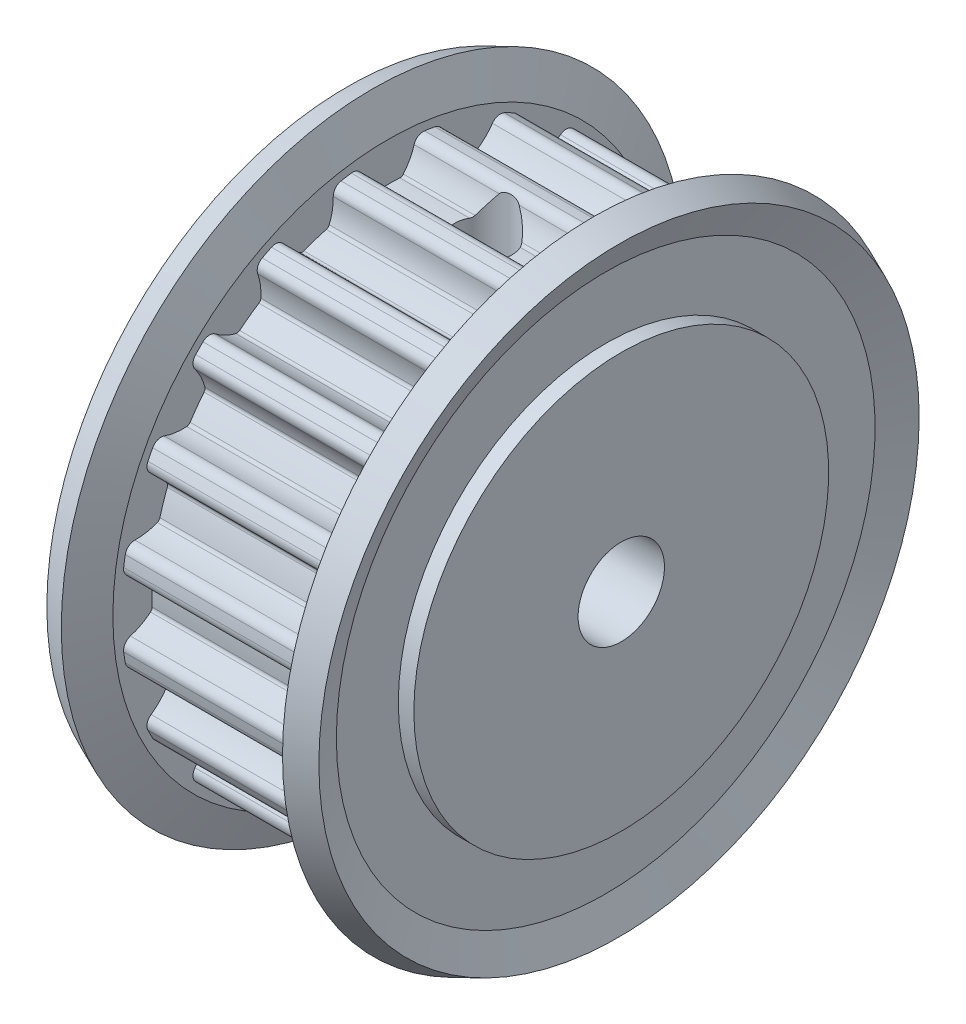
from build123d import *

# Parameters (mm, degrees)
SKETCH_2_W           = 16
SKETCH_2_H           = 18
CUT_EXTRUDE_1_DEPTH  = 11
CUT_EXTRUDE_2_DEPTH  = 11
CUT_EXTRUDE_3_DEPTH  = 11
CUT_EXTRUDE_4_DEPTH  = 11
CUT_EXTRUDE_5_DEPTH  = 11
CUT_EXTRUDE_6_DEPTH  = 11
CUT_EXTRUDE_7_DEPTH  = 11
CUT_EXTRUDE_8_DEPTH  = 11
CUT_EXTRUDE_9_DEPTH  = 11
CUT_EXTRUDE_10_DEPTH = 11
CUT_EXTRUDE_11_DEPTH = 11
CUT_EXTRUDE_12_DEPTH = 11
CUT_EXTRUDE_13_DEPTH = 11
CUT_EXTRUDE_14_DEPTH = 11
CUT_EXTRUDE_15_DEPTH = 11
CUT_EXTRUDE_16_DEPTH = 11
CUT_EXTRUDE_17_DEPTH = 11
CUT_EXTRUDE_18_DEPTH = 11
CUT_EXTRUDE_19_DEPTH = 11
CUT_EXTRUDE_20_DEPTH = 11
SKETCH_24_W          = 1.621
SKETCH_24_H          = 12.76


with BuildPart() as part:
    # 草图1 → 旋转1 (revolve)
    with BuildSketch(Plane.XY):
        Polygon((0, 12), (0, 2.5), (28, 2.5), (28, 4.175), (16, 4.175), (16, 12), (15.1, 12), (15.1, 15.584417878), (15.868987169, 17.365904819), (14.4, 18), (13.5, 15.915), (13.5, 15.435), (2.5, 15.435), (2.5, 15.915), (1.6, 18), (0.131012831, 17.365904819), (0.9, 15.584417878), (0.9, 12), align=None)
    revolve(axis=Axis((28, 0, 0), (-1, 0, 0)))

    # 草图2 → 切除-旋转1 (revolve, cut)
    with BuildSketch(Plane.XY):
        with Locations((24, 9)):
            Rectangle(SKETCH_2_W, SKETCH_2_H)
    revolve(axis=Axis((32, 0, 0), (-1, 0, 0)), mode=Mode.SUBTRACT)

    # 草图3 → 切除-拉伸1 (cut)
    with BuildSketch(Plane(origin=(2.5, 0, 0), x_dir=(0, 0, -1), z_dir=(1, 0, 0))):
        with BuildLine():
            Line((2.117582594, 15.289050623), (2.117582594, 20.58))
            Line((2.117582594, 20.58), (-2.117582594, 20.58))
            Line((-2.117582594, 20.58), (-2.117582594, 15.289050623))
            ThreePointArc((-2.117582594, 15.289050623), (-1.744204447, 15.206574401), (-1.514826938, 14.900634005))
            ThreePointArc((-1.514826938, 14.900634005), (-1.262981105, 14.287416305), (-0.892805689, 13.737477734))
            ThreePointArc((-0.892805689, 13.737477734), (-0.801013519, 13.668400532), (-0.688019523, 13.647668451))
            ThreePointArc((-0.688019523, 13.647668451), (0, 13.665), (0.688019523, 13.647668451))
            ThreePointArc((0.688019523, 13.647668451), (0.801013545, 13.668400543), (0.892805724, 13.737477777))
            ThreePointArc((0.892805724, 13.737477777), (1.26298113, 14.287416352), (1.514826953, 14.900634054))
            ThreePointArc((1.514826953, 14.900634054), (1.744204469, 15.206574415), (2.117582594, 15.289050623))
        make_face()
    extrude(amount=CUT_EXTRUDE_1_DEPTH, mode=Mode.SUBTRACT)

    # 草图5 → 切除-拉伸2 (cut)
    with BuildSketch(Plane(origin=(2.5, 0, 0), x_dir=(0, 0, -1), z_dir=(1, 0, 0))):
        with BuildLine():
            Line((-2.710635746, 15.195120232), (-4.34562902, 20.227112114))
            Line((-4.34562902, 20.227112114), (-8.373510469, 18.918374097))
            Line((-8.373510469, 18.918374097), (-6.738517195, 13.886382215))
            ThreePointArc((-6.738517195, 13.886382215), (-6.357926921, 13.923322859), (-6.045235165, 13.7032378))
            ThreePointArc((-6.045235165, 13.7032378), (-5.616220854, 13.197857753), (-5.094222748, 12.789225586))
            ThreePointArc((-5.094222748, 12.789225586), (-4.985577177, 12.751894603), (-4.871706936, 12.767094287))
            ThreePointArc((-4.871706936, 12.767094287), (-4.222717228, 12.996187295), (-3.563016034, 13.192313737))
            ThreePointArc((-3.563016034, 13.192313737), (-3.461958902, 13.246948202), (-3.396005391, 13.341009898))
            ThreePointArc((-3.396005391, 13.341009898), (-3.213888025, 13.978423056), (-3.163863105, 14.639452386))
            ThreePointArc((-3.163863105, 14.639452386), (-3.040252895, 15.001300511), (-2.710635746, 15.195120232))
        make_face()
    extrude(amount=CUT_EXTRUDE_2_DEPTH, mode=Mode.SUBTRACT)

    # 草图6 → 切除-拉伸3 (cut)
    with BuildSketch(Plane(origin=(2.5, 0, 0), x_dir=(0, 0, -1), z_dir=(1, 0, 0))):
        with BuildLine():
            Line((-7.273518173, 13.613785601), (-10.383460187, 17.894253563))
            Line((-10.383460187, 17.894253563), (-13.809780797, 15.404885925))
            Line((-13.809780797, 15.404885925), (-10.699838783, 11.124417963))
            ThreePointArc((-10.699838783, 11.124417963), (-10.34929121, 11.277159466), (-9.983893654, 11.164473203))
            ThreePointArc((-9.983893654, 11.164473203), (-9.419705775, 10.816400929), (-8.796981791, 10.58907493))
            ThreePointArc((-8.796981791, 10.58907493), (-8.682117805, 10.587144383), (-8.57851773, 10.636787981))
            ThreePointArc((-8.57851773, 10.636787981), (-8.032085473, 11.055217228), (-7.465278757, 11.445603439))
            ThreePointArc((-7.465278757, 11.445603439), (-7.386050691, 11.528792273), (-7.352391837, 11.638631019))
            ThreePointArc((-7.352391837, 11.638631019), (-7.376159427, 12.301124317), (-7.532852198, 12.94525912))
            ThreePointArc((-7.532852198, 12.94525912), (-7.527109122, 13.327594792), (-7.273518173, 13.613785601))
        make_face()
    extrude(amount=CUT_EXTRUDE_3_DEPTH, mode=Mode.SUBTRACT)

    # 草图7 → 切除-拉伸4 (cut)
    with BuildSketch(Plane(origin=(2.5, 0, 0), x_dir=(0, 0, -1), z_dir=(1, 0, 0))):
        with BuildLine():
            Line((-11.124417963, 10.699838783), (-15.404885925, 13.809780797))
            Line((-15.404885925, 13.809780797), (-17.894253563, 10.383460187))
            Line((-17.894253563, 10.383460187), (-13.613785601, 7.273518173))
            ThreePointArc((-13.613785601, 7.273518173), (-13.327594768, 7.527109132), (-12.945259071, 7.532852181))
            ThreePointArc((-12.945259071, 7.532852181), (-12.301124264, 7.37615942), (-11.638630964, 7.352391841))
            ThreePointArc((-11.638630964, 7.352391841), (-11.528792249, 7.386050705), (-11.445603439, 7.465278757))
            ThreePointArc((-11.445603439, 7.465278757), (-11.055217228, 8.032085473), (-10.636787981, 8.57851773))
            ThreePointArc((-10.636787981, 8.57851773), (-10.587144377, 8.682117832), (-10.589074943, 8.796981844))
            ThreePointArc((-10.589074943, 8.796981844), (-10.816400952, 9.419705823), (-11.164473234, 9.983893695))
            ThreePointArc((-11.164473234, 9.983893695), (-11.277159464, 10.349291236), (-11.124417963, 10.699838783))
        make_face()
    extrude(amount=CUT_EXTRUDE_4_DEPTH, mode=Mode.SUBTRACT)

    # 草图8 → 切除-拉伸5 (cut)
    with BuildSketch(Plane(origin=(2.5, 0, 0), x_dir=(0, 0, -1), z_dir=(1, 0, 0))):
        with BuildLine():
            Line((-13.886382215, 6.738517195), (-18.918374097, 8.373510469))
            Line((-18.918374097, 8.373510469), (-20.227112114, 4.34562902))
            Line((-20.227112114, 4.34562902), (-15.195120232, 2.710635746))
            ThreePointArc((-15.195120232, 2.710635746), (-15.001300491, 3.040252911), (-14.639452335, 3.163863104))
            ThreePointArc((-14.639452335, 3.163863104), (-13.978423003, 3.213888034), (-13.341009847, 3.396005412))
            ThreePointArc((-13.341009847, 3.396005412), (-13.246948183, 3.461958923), (-13.192313737, 3.563016034))
            ThreePointArc((-13.192313737, 3.563016034), (-12.996187295, 4.222717228), (-12.767094287, 4.871706936))
            ThreePointArc((-12.767094287, 4.871706936), (-12.751894606, 4.985577205), (-12.789225615, 5.094222795))
            ThreePointArc((-12.789225615, 5.094222795), (-13.19785779, 5.616220893), (-13.703237842, 6.045235194))
            ThreePointArc((-13.703237842, 6.045235194), (-13.923322866, 6.357926946), (-13.886382215, 6.738517195))
        make_face()
    extrude(amount=CUT_EXTRUDE_5_DEPTH, mode=Mode.SUBTRACT)

    # 草图9 → 切除-拉伸6 (cut)
    with BuildSketch(Plane(origin=(2.5, 0, 0), x_dir=(0, 0, -1), z_dir=(1, 0, 0))):
        with BuildLine():
            Line((-15.289050623, 2.117582594), (-20.58, 2.117582594))
            Line((-20.58, 2.117582594), (-20.58, -2.117582594))
            Line((-20.58, -2.117582594), (-15.289050623, -2.117582594))
            ThreePointArc((-15.289050623, -2.117582594), (-15.206574401, -1.744204447), (-14.900634005, -1.514826938))
            ThreePointArc((-14.900634005, -1.514826938), (-14.287416305, -1.262981105), (-13.737477734, -0.892805689))
            ThreePointArc((-13.737477734, -0.892805689), (-13.668400532, -0.801013519), (-13.647668451, -0.688019523))
            ThreePointArc((-13.647668451, -0.688019523), (-13.665, 0), (-13.647668451, 0.688019523))
            ThreePointArc((-13.647668451, 0.688019523), (-13.668400543, 0.801013545), (-13.737477777, 0.892805724))
            ThreePointArc((-13.737477777, 0.892805724), (-14.287416352, 1.26298113), (-14.900634054, 1.514826953))
            ThreePointArc((-14.900634054, 1.514826953), (-15.206574415, 1.744204469), (-15.289050623, 2.117582594))
        make_face()
    extrude(amount=CUT_EXTRUDE_6_DEPTH, mode=Mode.SUBTRACT)

    # 草图10 → 切除-拉伸7 (cut)
    with BuildSketch(Plane(origin=(2.5, 0, 0), x_dir=(0, 0, -1), z_dir=(1, 0, 0))):
        with BuildLine():
            Line((-15.195120232, -2.710635746), (-20.227112114, -4.34562902))
            Line((-20.227112114, -4.34562902), (-18.918374097, -8.373510469))
            Line((-18.918374097, -8.373510469), (-13.886382215, -6.738517195))
            ThreePointArc((-13.886382215, -6.738517195), (-13.923322859, -6.357926921), (-13.7032378, -6.045235165))
            ThreePointArc((-13.7032378, -6.045235165), (-13.197857753, -5.616220854), (-12.789225586, -5.094222748))
            ThreePointArc((-12.789225586, -5.094222748), (-12.751894603, -4.985577177), (-12.767094287, -4.871706936))
            ThreePointArc((-12.767094287, -4.871706936), (-12.996187295, -4.222717228), (-13.192313737, -3.563016034))
            ThreePointArc((-13.192313737, -3.563016034), (-13.246948202, -3.461958902), (-13.341009898, -3.396005391))
            ThreePointArc((-13.341009898, -3.396005391), (-13.978423056, -3.213888025), (-14.639452386, -3.163863105))
            ThreePointArc((-14.639452386, -3.163863105), (-15.001300511, -3.040252895), (-15.195120232, -2.710635746))
        make_face()
    extrude(amount=CUT_EXTRUDE_7_DEPTH, mode=Mode.SUBTRACT)

    # 草图11 → 切除-拉伸8 (cut)
    with BuildSketch(Plane(origin=(2.5, 0, 0), x_dir=(0, 0, -1), z_dir=(1, 0, 0))):
        with BuildLine():
            Line((-13.613785601, -7.273518173), (-17.894253563, -10.383460187))
            Line((-17.894253563, -10.383460187), (-15.404885925, -13.809780797))
            Line((-15.404885925, -13.809780797), (-11.124417963, -10.699838783))
            ThreePointArc((-11.124417963, -10.699838783), (-11.277159466, -10.34929121), (-11.164473203, -9.983893654))
            ThreePointArc((-11.164473203, -9.983893654), (-10.816400929, -9.419705775), (-10.58907493, -8.796981791))
            ThreePointArc((-10.58907493, -8.796981791), (-10.587144383, -8.682117805), (-10.636787981, -8.57851773))
            ThreePointArc((-10.636787981, -8.57851773), (-11.055217228, -8.032085473), (-11.445603439, -7.465278757))
            ThreePointArc((-11.445603439, -7.465278757), (-11.528792273, -7.386050691), (-11.638631019, -7.352391837))
            ThreePointArc((-11.638631019, -7.352391837), (-12.301124317, -7.376159427), (-12.94525912, -7.532852198))
            ThreePointArc((-12.94525912, -7.532852198), (-13.327594792, -7.527109122), (-13.613785601, -7.273518173))
        make_face()
    extrude(amount=CUT_EXTRUDE_8_DEPTH, mode=Mode.SUBTRACT)

    # 草图12 → 切除-拉伸9 (cut)
    with BuildSketch(Plane(origin=(2.5, 0, 0), x_dir=(0, 0, -1), z_dir=(1, 0, 0))):
        with BuildLine():
            Line((-10.699838783, -11.124417963), (-13.809780797, -15.404885925))
            Line((-13.809780797, -15.404885925), (-10.383460187, -17.894253563))
            Line((-10.383460187, -17.894253563), (-7.273518173, -13.613785601))
            ThreePointArc((-7.273518173, -13.613785601), (-7.527109132, -13.327594768), (-7.532852181, -12.945259071))
            ThreePointArc((-7.532852181, -12.945259071), (-7.37615942, -12.301124264), (-7.352391841, -11.638630964))
            ThreePointArc((-7.352391841, -11.638630964), (-7.386050705, -11.528792249), (-7.465278757, -11.445603439))
            ThreePointArc((-7.465278757, -11.445603439), (-8.032085473, -11.055217228), (-8.57851773, -10.636787981))
            ThreePointArc((-8.57851773, -10.636787981), (-8.682117832, -10.587144377), (-8.796981844, -10.589074943))
            ThreePointArc((-8.796981844, -10.589074943), (-9.419705823, -10.816400952), (-9.983893695, -11.164473234))
            ThreePointArc((-9.983893695, -11.164473234), (-10.349291236, -11.277159464), (-10.699838783, -11.124417963))
        make_face()
    extrude(amount=CUT_EXTRUDE_9_DEPTH, mode=Mode.SUBTRACT)

    # 草图13 → 切除-拉伸10 (cut)
    with BuildSketch(Plane(origin=(2.5, 0, 0), x_dir=(0, 0, -1), z_dir=(1, 0, 0))):
        with BuildLine():
            Line((-6.738517195, -13.886382215), (-8.373510469, -18.918374097))
            Line((-8.373510469, -18.918374097), (-4.34562902, -20.227112114))
            Line((-4.34562902, -20.227112114), (-2.710635746, -15.195120232))
            ThreePointArc((-2.710635746, -15.195120232), (-3.040252911, -15.001300491), (-3.163863104, -14.639452335))
            ThreePointArc((-3.163863104, -14.639452335), (-3.213888034, -13.978423003), (-3.396005412, -13.341009847))
            ThreePointArc((-3.396005412, -13.341009847), (-3.461958923, -13.246948183), (-3.563016034, -13.192313737))
            ThreePointArc((-3.563016034, -13.192313737), (-4.222717228, -12.996187295), (-4.871706936, -12.767094287))
            ThreePointArc((-4.871706936, -12.767094287), (-4.985577205, -12.751894606), (-5.094222795, -12.789225615))
            ThreePointArc((-5.094222795, -12.789225615), (-5.616220893, -13.19785779), (-6.045235194, -13.703237842))
            ThreePointArc((-6.045235194, -13.703237842), (-6.357926946, -13.923322866), (-6.738517195, -13.886382215))
        make_face()
    extrude(amount=CUT_EXTRUDE_10_DEPTH, mode=Mode.SUBTRACT)

    # 草图14 → 切除-拉伸11 (cut)
    with BuildSketch(Plane(origin=(2.5, 0, 0), x_dir=(0, 0, -1), z_dir=(1, 0, 0))):
        with BuildLine():
            Line((-2.117582618, -15.289050592), (-2.117582697, -20.579999968))
            Line((-2.117582697, -20.579999968), (2.117582491, -20.580000032))
            Line((2.117582491, -20.580000032), (2.117582569, -15.289050655))
            ThreePointArc((2.117582569, -15.289050655), (1.744204424, -15.206574427), (1.51482692, -14.900634027))
            ThreePointArc((1.51482692, -14.900634027), (1.262981096, -14.287416324), (0.892805688, -13.737477747))
            ThreePointArc((0.892805688, -13.737477747), (0.801013519, -13.668400544), (0.688019523, -13.647668461))
            ThreePointArc((0.688019523, -13.647668461), (0, -13.665), (-0.688019523, -13.64766844))
            ThreePointArc((-0.688019523, -13.64766844), (-0.801013545, -13.668400531), (-0.892805725, -13.737477763))
            ThreePointArc((-0.892805725, -13.737477763), (-1.26298114, -14.287416333), (-1.514826971, -14.900634032))
            ThreePointArc((-1.514826971, -14.900634032), (-1.744204492, -15.206574389), (-2.117582618, -15.289050592))
        make_face()
    extrude(amount=CUT_EXTRUDE_11_DEPTH, mode=Mode.SUBTRACT)

    # 草图15 → 切除-拉伸12 (cut)
    with BuildSketch(Plane(origin=(2.5, 0, 0), x_dir=(0, 0, -1), z_dir=(1, 0, 0))):
        with BuildLine():
            Line((2.710635746, -15.195120232), (4.34562902, -20.227112114))
            Line((4.34562902, -20.227112114), (8.373510469, -18.918374097))
            Line((8.373510469, -18.918374097), (6.738517195, -13.886382215))
            ThreePointArc((6.738517195, -13.886382215), (6.357926921, -13.923322859), (6.045235165, -13.7032378))
            ThreePointArc((6.045235165, -13.7032378), (5.616220854, -13.197857753), (5.094222748, -12.789225586))
            ThreePointArc((5.094222748, -12.789225586), (4.985577177, -12.751894603), (4.871706936, -12.767094287))
            ThreePointArc((4.871706936, -12.767094287), (4.222717228, -12.996187295), (3.563016034, -13.192313737))
            ThreePointArc((3.563016034, -13.192313737), (3.461958902, -13.246948202), (3.396005391, -13.341009898))
            ThreePointArc((3.396005391, -13.341009898), (3.213888025, -13.978423056), (3.163863105, -14.639452386))
            ThreePointArc((3.163863105, -14.639452386), (3.040252895, -15.001300511), (2.710635746, -15.195120232))
        make_face()
    extrude(amount=CUT_EXTRUDE_12_DEPTH, mode=Mode.SUBTRACT)

    # 草图16 → 切除-拉伸13 (cut)
    with BuildSketch(Plane(origin=(2.5, 0, 0), x_dir=(0, 0, -1), z_dir=(1, 0, 0))):
        with BuildLine():
            Line((7.273518173, -13.613785601), (10.383460187, -17.894253563))
            Line((10.383460187, -17.894253563), (13.809780797, -15.404885925))
            Line((13.809780797, -15.404885925), (10.699838783, -11.124417963))
            ThreePointArc((10.699838783, -11.124417963), (10.34929121, -11.277159466), (9.983893654, -11.164473203))
            ThreePointArc((9.983893654, -11.164473203), (9.419705775, -10.816400929), (8.796981791, -10.58907493))
            ThreePointArc((8.796981791, -10.58907493), (8.682117805, -10.587144383), (8.57851773, -10.636787981))
            ThreePointArc((8.57851773, -10.636787981), (8.032085473, -11.055217228), (7.465278757, -11.445603439))
            ThreePointArc((7.465278757, -11.445603439), (7.386050691, -11.528792273), (7.352391837, -11.638631019))
            ThreePointArc((7.352391837, -11.638631019), (7.376159427, -12.301124317), (7.532852198, -12.94525912))
            ThreePointArc((7.532852198, -12.94525912), (7.527109122, -13.327594792), (7.273518173, -13.613785601))
        make_face()
    extrude(amount=CUT_EXTRUDE_13_DEPTH, mode=Mode.SUBTRACT)

    # 草图17 → 切除-拉伸14 (cut)
    with BuildSketch(Plane(origin=(2.5, 0, 0), x_dir=(0, 0, -1), z_dir=(1, 0, 0))):
        with BuildLine():
            Line((11.124417963, -10.699838783), (15.404885925, -13.809780797))
            Line((15.404885925, -13.809780797), (17.894253563, -10.383460187))
            Line((17.894253563, -10.383460187), (13.613785601, -7.273518173))
            ThreePointArc((13.613785601, -7.273518173), (13.327594768, -7.527109132), (12.945259071, -7.532852181))
            ThreePointArc((12.945259071, -7.532852181), (12.301124264, -7.37615942), (11.638630964, -7.352391841))
            ThreePointArc((11.638630964, -7.352391841), (11.528792249, -7.386050705), (11.445603439, -7.465278757))
            ThreePointArc((11.445603439, -7.465278757), (11.055217228, -8.032085473), (10.636787981, -8.57851773))
            ThreePointArc((10.636787981, -8.57851773), (10.587144377, -8.682117832), (10.589074943, -8.796981844))
            ThreePointArc((10.589074943, -8.796981844), (10.816400952, -9.419705823), (11.164473234, -9.983893695))
            ThreePointArc((11.164473234, -9.983893695), (11.277159464, -10.349291236), (11.124417963, -10.699838783))
        make_face()
    extrude(amount=CUT_EXTRUDE_14_DEPTH, mode=Mode.SUBTRACT)

    # 草图18 → 切除-拉伸15 (cut)
    with BuildSketch(Plane(origin=(2.5, 0, 0), x_dir=(0, 0, -1), z_dir=(1, 0, 0))):
        with BuildLine():
            Line((13.886382215, -6.738517195), (18.918374097, -8.373510469))
            Line((18.918374097, -8.373510469), (20.227112114, -4.34562902))
            Line((20.227112114, -4.34562902), (15.195120232, -2.710635746))
            ThreePointArc((15.195120232, -2.710635746), (15.001300491, -3.040252911), (14.639452335, -3.163863104))
            ThreePointArc((14.639452335, -3.163863104), (13.978423003, -3.213888034), (13.341009847, -3.396005412))
            ThreePointArc((13.341009847, -3.396005412), (13.246948183, -3.461958923), (13.192313737, -3.563016034))
            ThreePointArc((13.192313737, -3.563016034), (12.996187295, -4.222717228), (12.767094287, -4.871706936))
            ThreePointArc((12.767094287, -4.871706936), (12.751894606, -4.985577205), (12.789225615, -5.094222795))
            ThreePointArc((12.789225615, -5.094222795), (13.19785779, -5.616220893), (13.703237842, -6.045235194))
            ThreePointArc((13.703237842, -6.045235194), (13.923322866, -6.357926946), (13.886382215, -6.738517195))
        make_face()
    extrude(amount=CUT_EXTRUDE_15_DEPTH, mode=Mode.SUBTRACT)

    # 草图19 → 切除-拉伸16 (cut)
    with BuildSketch(Plane(origin=(2.5, 0, 0), x_dir=(0, 0, -1), z_dir=(1, 0, 0))):
        with BuildLine():
            Line((15.289050623, -2.117582594), (20.58, -2.117582594))
            Line((20.58, -2.117582594), (20.58, 2.117582594))
            Line((20.58, 2.117582594), (15.289050623, 2.117582594))
            ThreePointArc((15.289050623, 2.117582594), (15.206574401, 1.744204447), (14.900634005, 1.514826938))
            ThreePointArc((14.900634005, 1.514826938), (14.287416305, 1.262981105), (13.737477734, 0.892805689))
            ThreePointArc((13.737477734, 0.892805689), (13.668400532, 0.801013519), (13.647668451, 0.688019523))
            ThreePointArc((13.647668451, 0.688019523), (13.665, 0), (13.647668451, -0.688019523))
            ThreePointArc((13.647668451, -0.688019523), (13.668400543, -0.801013545), (13.737477777, -0.892805724))
            ThreePointArc((13.737477777, -0.892805724), (14.287416352, -1.26298113), (14.900634054, -1.514826953))
            ThreePointArc((14.900634054, -1.514826953), (15.206574415, -1.744204469), (15.289050623, -2.117582594))
        make_face()
    extrude(amount=CUT_EXTRUDE_16_DEPTH, mode=Mode.SUBTRACT)

    # 草图20 → 切除-拉伸17 (cut)
    with BuildSketch(Plane(origin=(2.5, 0, 0), x_dir=(0, 0, -1), z_dir=(1, 0, 0))):
        with BuildLine():
            Line((15.195120232, 2.710635746), (20.227112114, 4.34562902))
            Line((20.227112114, 4.34562902), (18.918374097, 8.373510469))
            Line((18.918374097, 8.373510469), (13.886382215, 6.738517195))
            ThreePointArc((13.886382215, 6.738517195), (13.923322859, 6.357926921), (13.7032378, 6.045235165))
            ThreePointArc((13.7032378, 6.045235165), (13.197857753, 5.616220854), (12.789225586, 5.094222748))
            ThreePointArc((12.789225586, 5.094222748), (12.751894603, 4.985577177), (12.767094287, 4.871706936))
            ThreePointArc((12.767094287, 4.871706936), (12.996187295, 4.222717228), (13.192313737, 3.563016034))
            ThreePointArc((13.192313737, 3.563016034), (13.246948202, 3.461958902), (13.341009898, 3.396005391))
            ThreePointArc((13.341009898, 3.396005391), (13.978423056, 3.213888025), (14.639452386, 3.163863105))
            ThreePointArc((14.639452386, 3.163863105), (15.001300511, 3.040252895), (15.195120232, 2.710635746))
        make_face()
    extrude(amount=CUT_EXTRUDE_17_DEPTH, mode=Mode.SUBTRACT)

    # 草图21 → 切除-拉伸18 (cut)
    with BuildSketch(Plane(origin=(2.5, 0, 0), x_dir=(0, 0, -1), z_dir=(1, 0, 0))):
        with BuildLine():
            Line((13.613785601, 7.273518173), (17.894253563, 10.383460187))
            Line((17.894253563, 10.383460187), (15.404885925, 13.809780797))
            Line((15.404885925, 13.809780797), (11.124417963, 10.699838783))
            ThreePointArc((11.124417963, 10.699838783), (11.277159466, 10.34929121), (11.164473203, 9.983893654))
            ThreePointArc((11.164473203, 9.983893654), (10.816400929, 9.419705775), (10.58907493, 8.796981791))
            ThreePointArc((10.58907493, 8.796981791), (10.587144383, 8.682117805), (10.636787981, 8.57851773))
            ThreePointArc((10.636787981, 8.57851773), (11.055217228, 8.032085473), (11.445603439, 7.465278757))
            ThreePointArc((11.445603439, 7.465278757), (11.528792273, 7.386050691), (11.638631019, 7.352391837))
            ThreePointArc((11.638631019, 7.352391837), (12.301124317, 7.376159427), (12.94525912, 7.532852198))
            ThreePointArc((12.94525912, 7.532852198), (13.327594792, 7.527109122), (13.613785601, 7.273518173))
        make_face()
    extrude(amount=CUT_EXTRUDE_18_DEPTH, mode=Mode.SUBTRACT)

    # 草图22 → 切除-拉伸19 (cut)
    with BuildSketch(Plane(origin=(2.5, 0, 0), x_dir=(0, 0, -1), z_dir=(1, 0, 0))):
        with BuildLine():
            Line((10.699838783, 11.124417963), (13.809780797, 15.404885925))
            Line((13.809780797, 15.404885925), (10.383460187, 17.894253563))
            Line((10.383460187, 17.894253563), (7.273518173, 13.613785601))
            ThreePointArc((7.273518173, 13.613785601), (7.527109132, 13.327594768), (7.532852181, 12.945259071))
            ThreePointArc((7.532852181, 12.945259071), (7.37615942, 12.301124264), (7.352391841, 11.638630964))
            ThreePointArc((7.352391841, 11.638630964), (7.386050705, 11.528792249), (7.465278757, 11.445603439))
            ThreePointArc((7.465278757, 11.445603439), (8.032085473, 11.055217228), (8.57851773, 10.636787981))
            ThreePointArc((8.57851773, 10.636787981), (8.682117832, 10.587144377), (8.796981844, 10.589074943))
            ThreePointArc((8.796981844, 10.589074943), (9.419705823, 10.816400952), (9.983893695, 11.164473234))
            ThreePointArc((9.983893695, 11.164473234), (10.349291236, 11.277159464), (10.699838783, 11.124417963))
        make_face()
    extrude(amount=CUT_EXTRUDE_19_DEPTH, mode=Mode.SUBTRACT)

    # 草图23 → 切除-拉伸20 (cut)
    with BuildSketch(Plane(origin=(2.5, 0, 0), x_dir=(0, 0, -1), z_dir=(1, 0, 0))):
        with BuildLine():
            Line((6.738517195, 13.886382215), (8.373510469, 18.918374097))
            Line((8.373510469, 18.918374097), (4.34562902, 20.227112114))
            Line((4.34562902, 20.227112114), (2.710635746, 15.195120232))
            ThreePointArc((2.710635746, 15.195120232), (3.040252911, 15.001300491), (3.163863104, 14.639452335))
            ThreePointArc((3.163863104, 14.639452335), (3.213888034, 13.978423003), (3.396005412, 13.341009847))
            ThreePointArc((3.396005412, 13.341009847), (3.461958923, 13.246948183), (3.563016034, 13.192313737))
            ThreePointArc((3.563016034, 13.192313737), (4.222717228, 12.996187295), (4.871706936, 12.767094287))
            ThreePointArc((4.871706936, 12.767094287), (4.985577205, 12.751894606), (5.094222795, 12.789225615))
            ThreePointArc((5.094222795, 12.789225615), (5.616220893, 13.19785779), (6.045235194, 13.703237842))
            ThreePointArc((6.045235194, 13.703237842), (6.357926946, 13.923322866), (6.738517195, 13.886382215))
        make_face()
    extrude(amount=CUT_EXTRUDE_20_DEPTH, mode=Mode.SUBTRACT)

    # 草图24 → 切除-旋转2 (revolve, cut)
    with BuildSketch(Plane(origin=(8, 0, 0), x_dir=(0, 0, -1), z_dir=(1, 0, 0))):
        with Locations((0.8105, 9.055)):
            Rectangle(SKETCH_24_W, SKETCH_24_H)
    revolve(axis=Axis((8, 2.675, 0), (0, 1, 0)), mode=Mode.SUBTRACT)

    # 草图25 → 切除-旋转3 (revolve, cut)
    with BuildSketch(Plane(origin=(8, 0, 0), x_dir=(0, 0, -1), z_dir=(1, 0, 0))):
        Polygon((12.487177308, -9.072465369), (11.534377414, -10.383881917), (-0.952799894, -1.311416548), (0, 0), align=None)
    revolve(axis=Axis((8, 0, 0), (0, -0.5877852522924729, -0.8090169943749476)), mode=Mode.SUBTRACT)


solid = part.part
